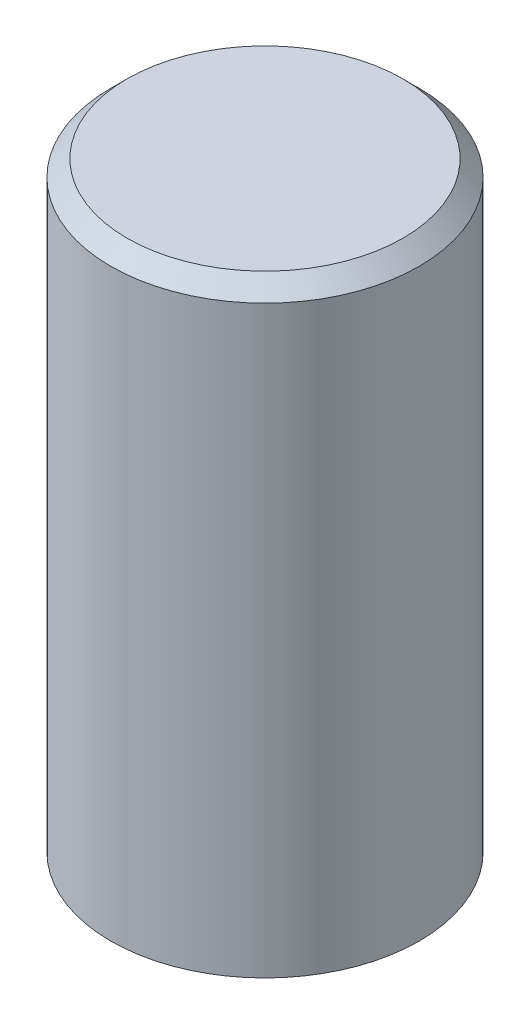
from build123d import *

# Parameters (mm, degrees)
SKETCH_1_R          = 9.5
EXTRUDE_1_DEPTH     = 37
SKETCH_2_R          = 7.5
CUT_EXTRUDE_1_DEPTH = 7
CHAMFER_1_SIZE      = 1
CHAMFER_2_SIZE      = 0.5


with BuildPart() as part:
    # 草图1 → 凸台-拉伸1 (new body)
    with BuildSketch(Plane(origin=(0, 0, 0), x_dir=(1, 0, 0), z_dir=(0, 1, 0))):
        with Locations(Location((0, 0, 0), (0, 0, 270))):
            Circle(SKETCH_1_R)
    extrude(amount=EXTRUDE_1_DEPTH)

    # 草图2 → 切除-拉伸1 (cut)
    with BuildSketch(Plane.XZ):
        with Locations(Location((0, 0, 0), (0, 0, 270))):
            Circle(SKETCH_2_R)
    extrude(amount=-CUT_EXTRUDE_1_DEPTH, mode=Mode.SUBTRACT)

    # 倒角1
    chamfer_1_edges = [part.edges().sort_by_distance(p)[0] for p in [
        (0, 37, -9.5),
    ]]
    chamfer(chamfer_1_edges, length=CHAMFER_1_SIZE)

    # 倒角2
    chamfer_2_edges = [part.edges().sort_by_distance(p)[0] for p in [
        (0, 0, 7.5),
    ]]
    chamfer(chamfer_2_edges, length=CHAMFER_2_SIZE)


solid = part.part
